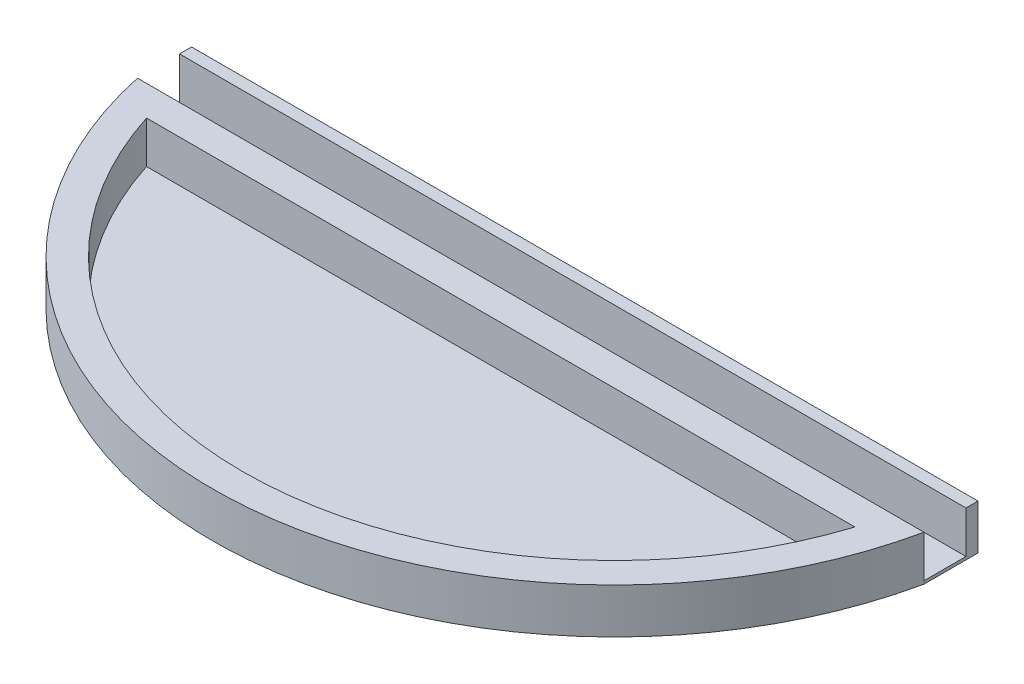
from build123d import *

# Parameters (mm, degrees)
SKETCH1_W           = 129
SKETCH1_H           = 7
BOSS_EXTRUDE1_DEPTH = 7
BOSS_EXTRUDE2_START = 0.5
BOSS_EXTRUDE2_DEPTH = 0.5
SKETCH3_W           = 131
SKETCH3_H           = 7
CUT_EXTRUDE4_DEPTH  = 7
CUT_EXTRUDE5_DEPTH  = 7


with BuildPart() as part:
    # Sketch1 → Boss-Extrude1 (new body)
    with BuildSketch(Plane(origin=(0, 0, 0), x_dir=(1, 0, 0), z_dir=(0, 1, 0))):
        with BuildLine():
            Line((-65.5, 5.5), (-65.5, -3.5))
            ThreePointArc((-65.5, -3.5), (0, -56.5), (65.5, -3.5))
            Line((65.5, -3.5), (65.5, 5.5))
            Line((65.5, 5.5), (-65.5, 5.5))
        make_face()
        Rectangle(SKETCH1_W, SKETCH1_H, mode=Mode.SUBTRACT)
    extrude(amount=BOSS_EXTRUDE1_DEPTH)

    # Sketch2 → Boss-Extrude2 (add)
    with BuildSketch(Plane.XZ.offset(BOSS_EXTRUDE2_START)):
        with BuildLine():
            Line((-65.5, -5.5), (65.5, -5.5))
            Line((65.5, -5.5), (65.5, 3.5))
            ThreePointArc((65.5, 3.5), (0, 56.5), (-65.5, 3.5))
            Line((-65.5, 3.5), (-65.5, -5.5))
        make_face()
    extrude(amount=-BOSS_EXTRUDE2_DEPTH)

    # Sketch3 → Cut-Extrude4 (cut)
    with BuildSketch(Plane(origin=(0, 7, 0), x_dir=(1, 0, 0), z_dir=(0, 1, 0))):
        Rectangle(SKETCH3_W, SKETCH3_H)
    extrude(amount=-CUT_EXTRUDE4_DEPTH, mode=Mode.SUBTRACT)

    # Sketch4 → Cut-Extrude5 (cut)
    with BuildSketch(Plane(origin=(0, 7, 0), x_dir=(1, 0, 0), z_dir=(0, 1, 0))):
        with BuildLine():
            Line((58.998041221, -8.5), (-58.998041221, -8.5))
            ThreePointArc((-58.998041221, -8.5), (0, -51.5), (58.998041221, -8.5))
        make_face()
    extrude(amount=-CUT_EXTRUDE5_DEPTH, mode=Mode.SUBTRACT)


solid = part.part
